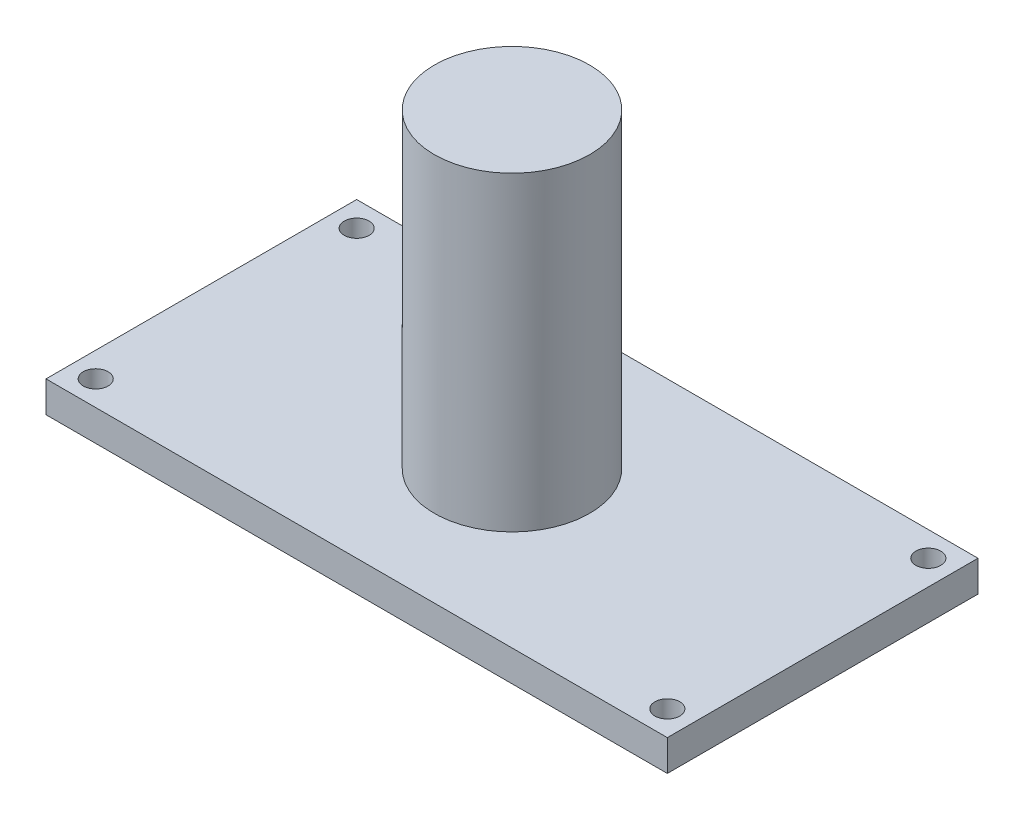
from build123d import *

# Parameters (mm, degrees)
SKETCH1_W           = 200
SKETCH1_H           = 100
SKETCH1_R           = 4
BOSS_EXTRUDE1_DEPTH = 10
SKETCH2_R           = 25
BOSS_EXTRUDE2_DEPTH = 100


with BuildPart() as part:
    # Sketch1 → Boss-Extrude1 (new body)
    with BuildSketch(Plane(origin=(0, 0, 0), x_dir=(1, 0, 0), z_dir=(0, 1, 0))):
        Rectangle(SKETCH1_W, SKETCH1_H)
        with Locations(Location((-92, 42, 0), (0, 0, 270))):
            Circle(SKETCH1_R, mode=Mode.SUBTRACT)
        with Locations(Location((-92, -42, 0), (0, 0, 270))):
            Circle(SKETCH1_R, mode=Mode.SUBTRACT)
        with Locations(Location((92, -42, 0), (0, 0, 270))):
            Circle(SKETCH1_R, mode=Mode.SUBTRACT)
        with Locations(Location((92, 42, 0), (0, 0, 270))):
            Circle(SKETCH1_R, mode=Mode.SUBTRACT)
    extrude(amount=BOSS_EXTRUDE1_DEPTH)

    # Sketch2 → Boss-Extrude2 (add)
    with BuildSketch(Plane(origin=(0, 10, 0), x_dir=(1, 0, 0), z_dir=(0, 1, 0))):
        with Locations(Location((0, 0, 0), (0, 0, 90))):
            Circle(SKETCH2_R)
    extrude(amount=BOSS_EXTRUDE2_DEPTH)


solid = part.part
